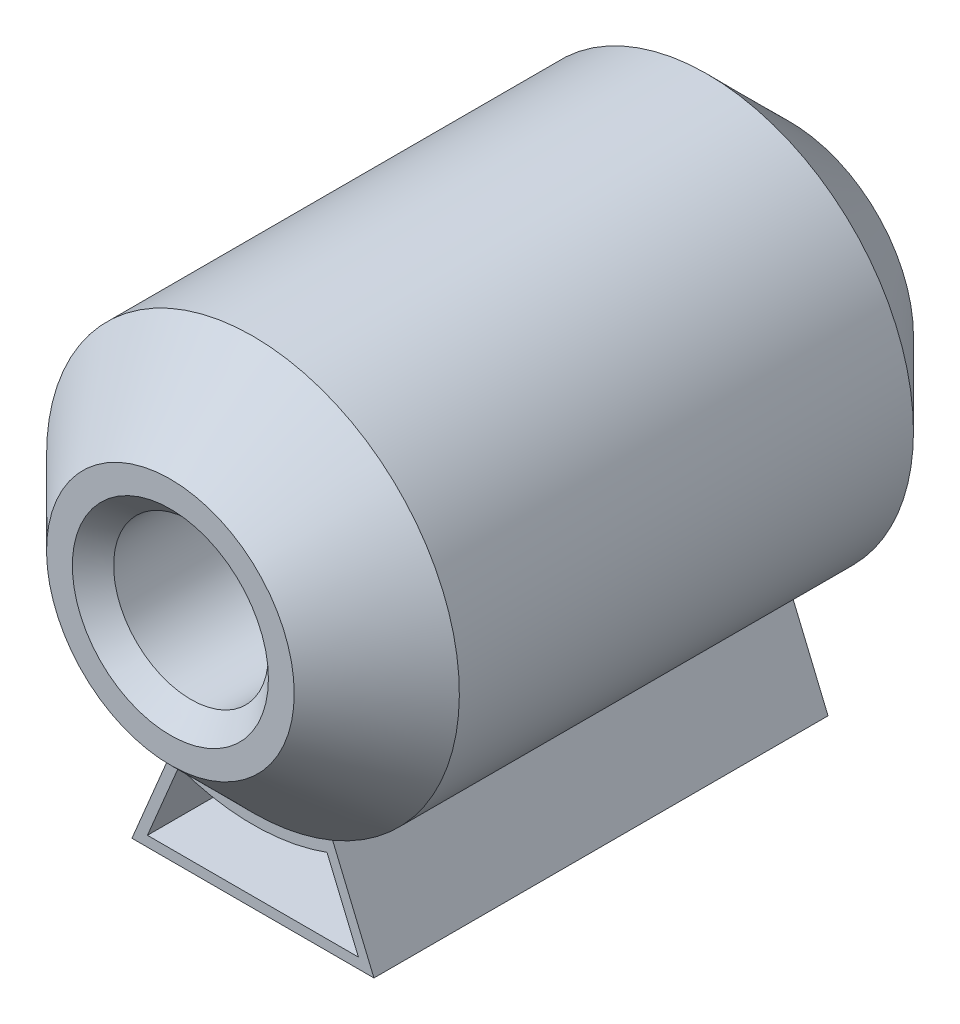
from build123d import *

# Parameters (mm, degrees)
SKETCH1_R           = 10
BOSS_EXTRUDE1_DEPTH = 15
CHAMFER1_SIZE       = 4
SKETCH2_R           = 3.75
CUT_EXTRUDE1_DEPTH  = 34.166247904
CHAMFER2_SIZE       = 1
BOSS_EXTRUDE2_DEPTH = 22


with BuildPart() as part:
    # Sketch1 → Boss-Extrude1 (new, symmetric)
    with BuildSketch(Plane.XY):
        Circle(SKETCH1_R)
    extrude(amount=BOSS_EXTRUDE1_DEPTH, both=True)

    # Chamfer1
    chamfer1_edges = [part.edges().sort_by_distance(p)[0] for p in [
        (-10, 0, -15),
        (-10, 0, 15),
    ]]
    chamfer(chamfer1_edges, length=CHAMFER1_SIZE)

    # Sketch2 → Cut-Extrude1 (cut, through all)
    with BuildSketch(Plane.XY.offset(15)):
        Circle(SKETCH2_R)
    extrude(amount=-CUT_EXTRUDE1_DEPTH, mode=Mode.SUBTRACT)

    # Chamfer2
    chamfer2_edges = [part.edges().sort_by_distance(p)[0] for p in [
        (-3.75, 0, -15),
        (-3.75, 0, 15),
    ]]
    chamfer(chamfer2_edges, length=CHAMFER2_SIZE)

    # Sketch3 → Boss-Extrude2 (add)
    with BuildSketch(Plane.XY.offset(11)):
        with BuildLine():
            Line((-3.862549243, -9.223920714), (-5.862549243, -14))
            Line((-5.862549243, -14), (5.862549243, -14))
            Line((5.862549243, -14), (3.862549243, -9.223920714))
            ThreePointArc((3.862549243, -9.223920714), (0, -10), (-3.862549243, -9.223920714))
        make_face()
        with BuildLine():
            Line((-3.589879787, -9.867257122), (-5.111103644, -13.5))
            Line((-5.111103644, -13.5), (5.111103644, -13.5))
            Line((5.111103644, -13.5), (3.589879787, -9.867257122))
            ThreePointArc((3.589879787, -9.867257122), (0, -10.5), (-3.589879787, -9.867257122))
        make_face(mode=Mode.SUBTRACT)
    extrude(amount=-BOSS_EXTRUDE2_DEPTH)


solid = part.part
